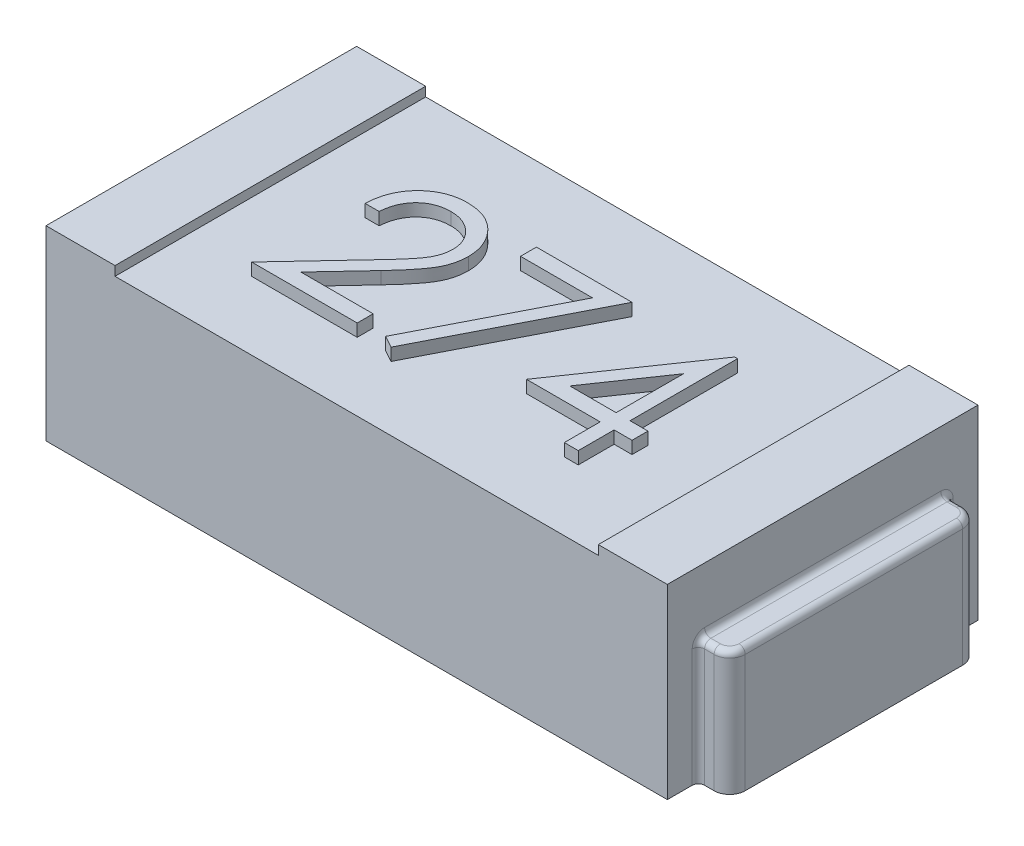
from build123d import *

# Parameters (mm, degrees)
ESQUISSE1_W             = 2
ESQUISSE1_H             = 1
BOSS_EXTRU_1_DEPTH      = 0.6
ESQUISSE2_W             = 1.555645222
ESQUISSE2_H             = 1
ENL_V_MAT_EXTRU_1_DEPTH = 0.03
BOSS_EXTRU_2_DEPTH      = 0.4
CONG_1_R                = 0.02
CONG_1_OF_SYM_TRIE2_R   = 0.02
BOSS_EXTRU_3_DEPTH      = 0.04


with BuildPart() as part:
    # Esquisse1 → Boss.-Extru.1 (new body)
    with BuildSketch(Plane(origin=(0, 0, 0), x_dir=(1, 0, 0), z_dir=(0, 1, 0))):
        Rectangle(ESQUISSE1_W, ESQUISSE1_H)
    extrude(amount=BOSS_EXTRU_1_DEPTH)

    # Esquisse2 → Enlèv. mat.-Extru.1 (cut)
    with BuildSketch(Plane(origin=(0, 0.6, 0), x_dir=(1, 0, 0), z_dir=(0, 1, 0))):
        Rectangle(ESQUISSE2_W, ESQUISSE2_H)
    extrude(amount=-ENL_V_MAT_EXTRU_1_DEPTH, mode=Mode.SUBTRACT)

    # Esquisse3 → Boss.-Extru.2 (add)
    with BuildSketch(Plane(origin=(0, 0, 0), x_dir=(1, 0, 0), z_dir=(0, 1, 0))):
        with BuildLine():
            Line((1, 0.4), (1.050552667, 0.4))
            ThreePointArc((1.050552667, 0.4), (1.085908006, 0.385355339), (1.100552667, 0.35))
            Line((1.100552667, 0.35), (1.100552667, -0.35))
            ThreePointArc((1.100552667, -0.35), (1.085908006, -0.385355339), (1.050552667, -0.4))
            Line((1.050552667, -0.4), (1, -0.4))
            Line((1, -0.4), (1, 0.4))
        make_face()
    boss_extru_2 = extrude(amount=BOSS_EXTRU_2_DEPTH)

    # Congé1
    cong_1_edges = [part.edges().sort_by_distance(p)[0] for p in [
        (1, 0.2, -0.4),
        (1, 0.2, 0.4),
        (1, 0.4, 0),
        (1.025276334, 0.4, 0.4),
        (1.085908006, 0.4, 0.385355339),
        (1.100552667, 0.4, 0),
        (1.085908006, 0.4, -0.385355339),
        (1.025276334, 0.4, -0.4),
    ]]
    fillet(cong_1_edges, radius=CONG_1_R)

    # Symétrie2: Boss.-Extru.2 across plane
    add(boss_extru_2.mirror(Plane(origin=(0, 0, 0), x_dir=(0, 0, 1), z_dir=(1, 0, 0))))

    # Congé1 of Symétrie2
    cong_1_of_sym_trie2_edges = [part.edges().sort_by_distance(p)[0] for p in [
        (-1, 0.2, -0.4),
        (-1, 0.2, 0.4),
        (-1, 0.4, 0),
        (-1.025276334, 0.4, 0.4),
        (-1.085908006, 0.4, 0.385355339),
        (-1.100552667, 0.4, 0),
        (-1.085908006, 0.4, -0.385355339),
        (-1.025276334, 0.4, -0.4),
    ]]
    fillet(cong_1_of_sym_trie2_edges, radius=CONG_1_OF_SYM_TRIE2_R)

    # Esquisse4 → Boss.-Extru.3 (add)
    # profile 1 of 3: a face of its own
    with BuildSketch(Plane(origin=(0, 0.57, 0), x_dir=(1, 0, 0), z_dir=(0, 1, 0))):
        Polygon((0.48447516, 0.23252099), (0.493589744, 0.23252099), (0.493589744, -0.113632856), (0.551282051, -0.113632856), (0.551282051, -0.164914907), (0.493589744, -0.164914907), (0.493589744, -0.280299523), (0.448717949, -0.280299523), (0.448717949, -0.164914907), (0.211538462, -0.164914907), align=None)
        Polygon((0.448717949, -0.113632856), (0.448717949, 0.10351458), (0.299679487, -0.113632856), align=None, mode=Mode.SUBTRACT)
    # profile 2 of 3: a face of its own
    with BuildSketch(Plane(origin=(0, 0.57, 0), x_dir=(1, 0, 0), z_dir=(0, 1, 0))):
        Polygon((-0.141025641, 0.219700477), (0.166666667, 0.219700477), (-0.096153846, -0.293120035), (-0.134915865, -0.271785901), (0.090745192, 0.168418426), (-0.141025641, 0.168418426), align=None)
    # profile 3 of 3: a face of its own
    with BuildSketch(Plane(origin=(0, 0.57, 0), x_dir=(1, 0, 0), z_dir=(0, 1, 0))):
        with BuildLine():
            Line((-0.493589744, 0.065854324), (-0.538461538, 0.065854324))
            add(Edge.make_bspline(
                [(-0.538461538, 0.065854324), (-0.538169088, 0.071807307), (-0.537594723, 0.08349881), (-0.534904968, 0.100545082), (-0.531056271, 0.116838625), (-0.525614635, 0.132248612), (-0.518856595, 0.146911299), (-0.510752305, 0.160768444), (-0.501153184, 0.173767185), (-0.490266507, 0.18578702), (-0.478442416, 0.196813816), (-0.465684425, 0.206335994), (-0.452277992, 0.214381375), (-0.438263792, 0.221107267), (-0.423483712, 0.226155816), (-0.408071875, 0.229901765), (-0.39196057, 0.232155528), (-0.380983424, 0.232397784), (-0.375400641, 0.23252099)],
                knots=[0, 0, 0, 0, 1.10065271, 2.161652631, 3.183658789, 4.190468796, 5.17591951, 6.163126047, 7.15150782, 8.156236427, 9.156009102, 10.134482811, 11.092018607, 12.041330605, 13.001268258, 13.972401359, 14.968799086, 16, 16, 16, 16], degree=3))
            add(Edge.make_bspline(
                [(-0.375400641, 0.23252099), (-0.369918059, 0.232392639), (-0.359144981, 0.232140434), (-0.343421836, 0.229974573), (-0.328453651, 0.226582346), (-0.314269685, 0.221823), (-0.300983104, 0.215425225), (-0.288494098, 0.207739862), (-0.276653982, 0.198851315), (-0.26599587, 0.188386485), (-0.256209001, 0.177214715), (-0.247765822, 0.165287872), (-0.24053537, 0.152969403), (-0.234508559, 0.140165374), (-0.230071968, 0.126755227), (-0.226703652, 0.112934198), (-0.224799736, 0.098559225), (-0.224507533, 0.088829717), (-0.224358974, 0.08388317)],
                knots=[0, 0, 0, 0, 1.111607364, 2.184268762, 3.212621178, 4.221274766, 5.211760367, 6.196651075, 7.1921475, 8.207485113, 9.220403448, 10.201281604, 11.166441695, 12.114753415, 13.065576456, 14.026450734, 14.996634279, 16, 16, 16, 16], degree=3))
            add(Edge.make_bspline(
                [(-0.224358974, 0.08388317), (-0.224600869, 0.076919193), (-0.225080414, 0.063113449), (-0.229182467, 0.042825611), (-0.235589112, 0.023169408), (-0.24330302, 0.007349794), (-0.251084798, -0.005397848), (-0.258097299, -0.015893378), (-0.266306557, -0.027194159), (-0.275832057, -0.03926235), (-0.286476753, -0.052192479), (-0.298337062, -0.065976736), (-0.31149756, -0.080472703), (-0.320734488, -0.090373503), (-0.325520833, -0.09550385)],
                knots=[0, 0, 0, 0, 1.184426356, 2.348067706, 3.509069118, 4.696110526, 5.333549288, 6.050745305, 6.844228056, 7.710549037, 8.667450064, 9.695053472, 10.805634456, 12, 12, 12, 12], degree=3))
            Line((-0.325520833, -0.09550385), (-0.450620994, -0.229017471))
            Line((-0.450620994, -0.229017471), (-0.217948718, -0.229017471))
            Line((-0.217948718, -0.229017471), (-0.217948718, -0.280299523))
            Line((-0.217948718, -0.280299523), (-0.557692308, -0.280299523))
            Line((-0.557692308, -0.280299523), (-0.363782051, -0.073368433))
            add(Edge.make_bspline(
                [(-0.363782051, -0.073368433), (-0.359060925, -0.068440103), (-0.349992606, -0.058973791), (-0.337166524, -0.045153368), (-0.325646669, -0.032332005), (-0.31535847, -0.020533927), (-0.306525112, -0.00958656), (-0.298686221, 0.000155541), (-0.292405423, 0.009120462), (-0.285588938, 0.019511978), (-0.27898694, 0.032199452), (-0.273313747, 0.047704265), (-0.269854482, 0.063665301), (-0.269439506, 0.074451306), (-0.269230769, 0.079876759)],
                knots=[0, 0, 0, 0, 1.329631726, 2.553950428, 3.673215718, 4.687767853, 5.603093632, 6.413772471, 7.123043292, 7.734684054, 8.834405432, 9.900288307, 10.943827018, 12, 12, 12, 12], degree=3))
            add(Edge.make_bspline(
                [(-0.269230769, 0.079876759), (-0.26932159, 0.083288388), (-0.269500579, 0.090012052), (-0.27108025, 0.099870018), (-0.273467465, 0.109379277), (-0.276888216, 0.11856908), (-0.281403465, 0.12734703), (-0.286899662, 0.135723813), (-0.2932411, 0.143822236), (-0.300576995, 0.151415565), (-0.308635784, 0.158370023), (-0.317149248, 0.164530606), (-0.326156406, 0.169679051), (-0.33561928, 0.17389955), (-0.34551149, 0.177210319), (-0.355852168, 0.179504402), (-0.366612742, 0.180944757), (-0.373960384, 0.181139638), (-0.377704327, 0.181238939)],
                knots=[0, 0, 0, 0, 0.991446411, 1.95395049, 2.89581595, 3.838931463, 4.798493298, 5.75982156, 6.748411868, 7.785213223, 8.824556874, 9.840280684, 10.836137867, 11.835679398, 12.848801643, 13.863922112, 14.911575587, 16, 16, 16, 16], degree=3))
            add(Edge.make_bspline(
                [(-0.377704327, 0.181238939), (-0.381614446, 0.181136791), (-0.389293274, 0.180936191), (-0.400567421, 0.179532953), (-0.411322533, 0.177112119), (-0.421585662, 0.173801165), (-0.431374174, 0.169592801), (-0.440640466, 0.164351123), (-0.449363736, 0.158096338), (-0.457560382, 0.15100483), (-0.465112379, 0.143109459), (-0.471747647, 0.134308036), (-0.477545363, 0.124761262), (-0.482603825, 0.114494898), (-0.486711781, 0.103415786), (-0.489850802, 0.091563257), (-0.492334638, 0.078988774), (-0.493164426, 0.07030519), (-0.493589744, 0.065854324)],
                knots=[0, 0, 0, 0, 1.031018746, 2.02475058, 2.990194455, 3.934040569, 4.864654155, 5.795059489, 6.735614925, 7.690564532, 8.649604399, 9.611025574, 10.590972636, 11.591080095, 12.624614302, 13.701020113, 14.821632451, 16, 16, 16, 16], degree=3))
        make_face()
    extrude(amount=BOSS_EXTRU_3_DEPTH)


solid = part.part
